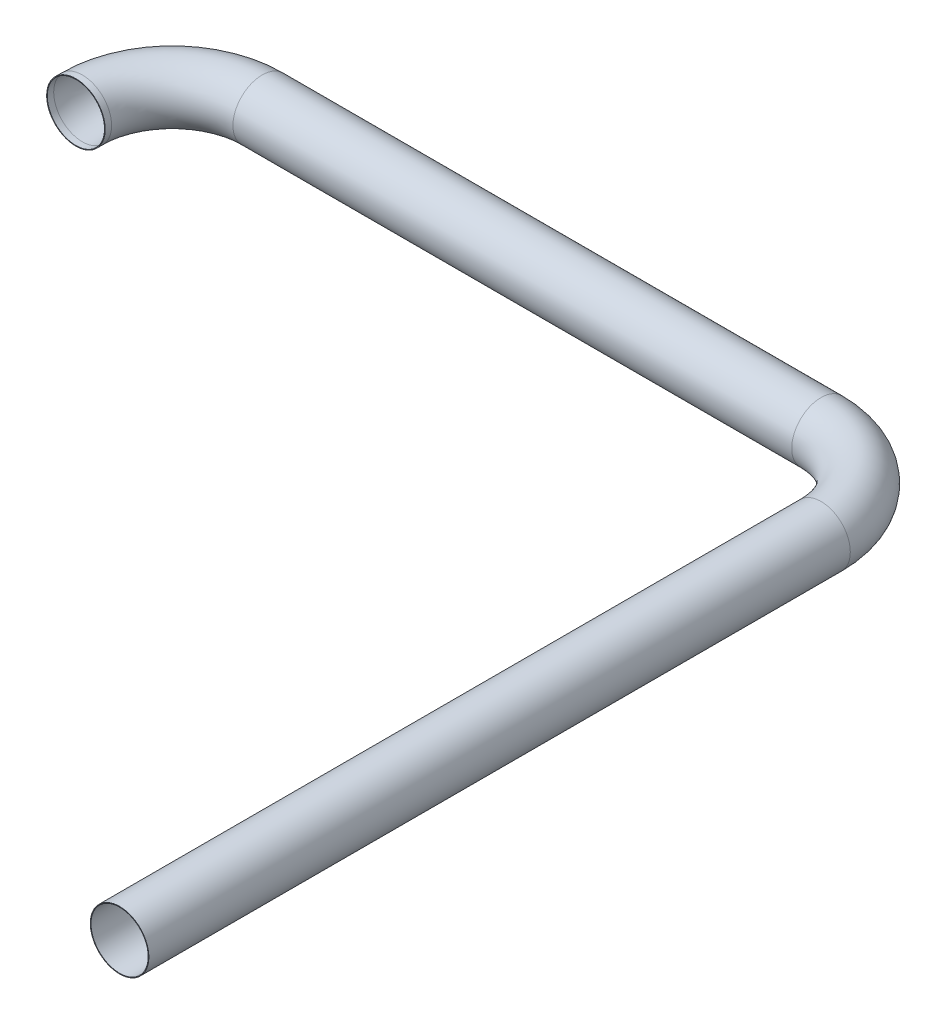
from build123d import *

# Parameters (mm, degrees)
SKETCH2_R   = 45.59
SKETCH2_R_2 = 44.59


with BuildPart() as part:
    # Sweep2: sweep along a path in Sketch1
    with BuildLine(Plane(origin=(0, 0, 0), x_dir=(1, 0, 0), z_dir=(0, 1, 0))) as sweep2_path:
        Line((0, 0), (0, 1092))
        ThreePointArc((0, 1092), (-41.005050634, 1190.994949366), (-140, 1232))
        Line((-140, 1232), (-1010, 1232))
        ThreePointArc((-1010, 1232), (-1108.994949366, 1190.994949366), (-1150, 1092))
        Line((-1150, 1092), (-1150, 1082))
    # Sketch2 → Sweep2 (sweep)
    with BuildSketch(Plane.XY):
        Circle(SKETCH2_R)
        Circle(SKETCH2_R_2, mode=Mode.SUBTRACT)
    sweep(path=sweep2_path.line)


solid = part.part
